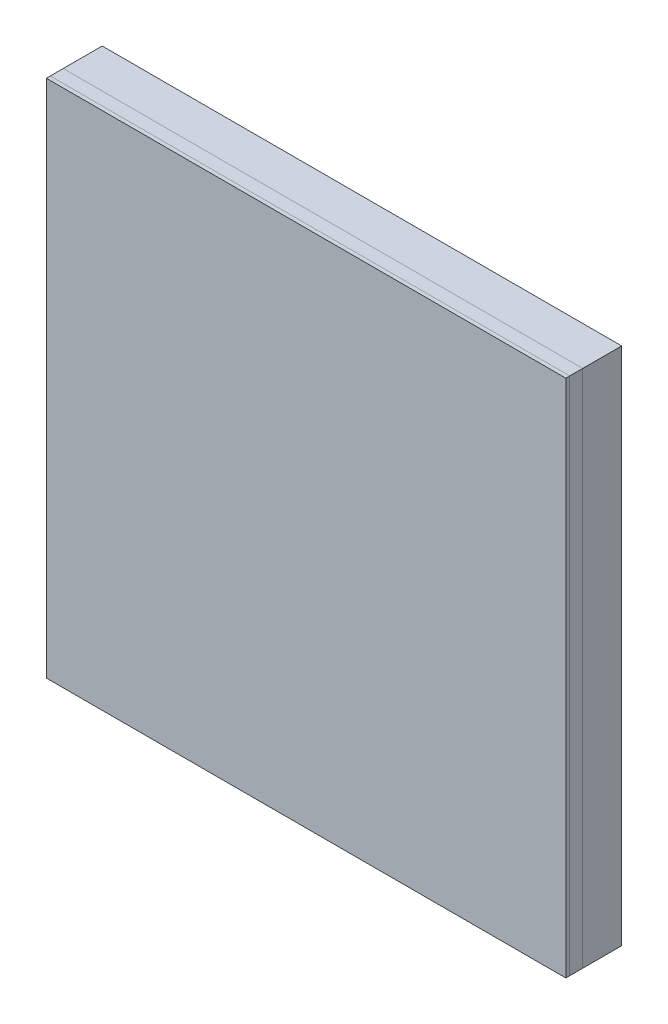
from build123d import *

# Parameters (mm, degrees)
EXTRUDE_340_DEPTH    = 0.6
EXTRUDE_519_DEPTH    = 0.065
EXTRUDE_519_2_DEPTH  = 0.065
SKETCH_2_W           = 7.8
SKETCH_2_H           = 0.65
EXTRUDE_519_3_DEPTH  = 0.065
EXTRUDE_START        = 0.6
EXTRUDE_2457_DEPTH   = 0.065
EXTRUDE_2457_2_DEPTH = 0.065
EXTRUDE_2457_3_DEPTH = 0.065
EXTRUDE_2457_4_DEPTH = 0.065
EXTRUDE_2457_5_DEPTH = 0.065
SKETCH_7_W           = 8
SKETCH_7_H           = 8
SKETCH_7_W_2         = 7.8
SKETCH_7_H_2         = 1.6503
SKETCH_7_H_3         = 1.334138265
SKETCH_7_H_4         = 1.2918
SKETCH_7_H_5         = 1.3338
EXTRUDE_2963_DEPTH   = 0.065
EXTRUDE_START_2      = 0.665
SKETCH_9_W           = 1.397
SKETCH_9_H           = 1.397
EXTRUDE_55E_DEPTH    = 0.135
EXTRUDE_55E_2_DEPTH  = 0.135
EXTRUDE_55E_3_DEPTH  = 0.135
EXTRUDE_55E_4_DEPTH  = 0.135
EXTRUDE_55E_5_DEPTH  = 0.135
EXTRUDE_55E_6_DEPTH  = 0.135
EXTRUDE_55E_7_DEPTH  = 0.135
EXTRUDE_55E_8_DEPTH  = 0.135
EXTRUDE_55E_9_DEPTH  = 0.135
EXTRUDE_55E_10_DEPTH = 0.135
EXTRUDE_55E_11_DEPTH = 0.135
EXTRUDE_55E_12_DEPTH = 0.135
EXTRUDE_55E_13_DEPTH = 0.135
EXTRUDE_55E_14_DEPTH = 0.135
EXTRUDE_55E_15_DEPTH = 0.135
EXTRUDE_55E_16_DEPTH = 0.135
SKETCH_10_W          = 1.397
SKETCH_10_H          = 1.397
EXTRUDE_4746_DEPTH   = 0.135
SKETCH_11_W          = 8
SKETCH_11_H          = 8
SKETCH_11_W_2        = 5.7448
SKETCH_11_H_2        = 5.7404
EXTRUDE_4922_DEPTH   = 0.135
CUT_EXTRUDE_35_DEPTH = 0.065
EXTRUDE_START_3      = 0.8
SKETCH_13_W          = 8
SKETCH_13_H          = 8
EXTRUDE_5314_DEPTH   = 0.06


with BuildPart() as part:
    # 草图1 → Extrude 340 (new body)
    with BuildSketch(Plane.XY):
        Polygon((0, 4), (-4, 4), (-4, -4), (4, -4), (4, 4), align=None)
    extrude(amount=EXTRUDE_340_DEPTH)


with BuildPart() as body_2:
    # 草图2 → Extrude 519 (new body)
    with BuildSketch(Plane.XY):
        Polygon((-3.6, 3.9), (-3.9, 3.6), (-3.9, 3.25), (3.9, 3.25), (3.9, 3.9), align=None)
    extrude(amount=-EXTRUDE_519_DEPTH)


with BuildPart() as body_3:
    # 草图2 → Extrude 519 2 (new body)
    with BuildSketch(Plane.XY):
        Polygon((-3.9, 0), (-3.9, 2.65), (3.9, 2.65), (3.9, -2.65), (-3.9, -2.65), align=None)
    extrude(amount=-EXTRUDE_519_2_DEPTH)

    # 草图12 → 背部35字符 (cut)
    with BuildSketch(Plane.XY):
        with BuildLine():
            add(Edge.make_bspline(
                [(0.175442408, 0.041162604), (0.171519721, 0.041314338), (0.163870978, 0.041610199), (0.152851761, 0.04431659), (0.142631687, 0.048502824), (0.134982054, 0.053530061), (0.129445763, 0.058209417), (0.125936778, 0.062275379), (0.122837738, 0.066580708), (0.120304091, 0.071296199), (0.118471723, 0.076449226), (0.117024538, 0.08190166), (0.116278483, 0.087757088), (0.116139105, 0.09175984), (0.116067408, 0.093818854)],
                knots=[0, 0, 0, 0, 1.580986218, 3.082722545, 4.552742743, 6.019301232, 6.756993619, 7.471942512, 8.18068244, 8.895476766, 9.623823266, 10.383578618, 11.168513387, 12, 12, 12, 12], degree=3))
            add(Edge.make_bspline(
                [(0.116067408, 0.093818854), (0.116216914, 0.096964342), (0.116510452, 0.103140136), (0.119311098, 0.11199984), (0.123801138, 0.120122187), (0.12986891, 0.127444304), (0.137465711, 0.133612633), (0.146519866, 0.138020548), (0.156769848, 0.140746835), (0.164018269, 0.141020399), (0.167786158, 0.141162604)],
                knots=[0, 0, 0, 0, 0.960649765, 1.886122081, 2.813754997, 3.787513425, 4.779794203, 5.785182105, 6.848688776, 8, 8, 8, 8], degree=3))
            add(Edge.make_bspline(
                [(0.167786158, 0.141162604), (0.170341454, 0.141136567), (0.175259806, 0.141086452), (0.182258513, 0.140184808), (0.188583301, 0.138912046), (0.194190908, 0.137024249), (0.199133873, 0.13464672), (0.203575189, 0.131977206), (0.207489402, 0.128964963), (0.212051434, 0.124230599), (0.21706547, 0.1169789), (0.222391493, 0.107126895), (0.227316857, 0.096614902), (0.230526301, 0.08957654), (0.232083033, 0.086162604)],
                knots=[0, 0, 0, 0, 0.998645702, 1.922161417, 2.755195104, 3.518563503, 4.229288931, 4.896574638, 5.542450423, 6.154682312, 7.460691044, 8.974324908, 10.532405416, 12, 12, 12, 12], degree=3))
            add(Edge.make_bspline(
                [(0.232083033, 0.086162604), (0.232579617, 0.085465166), (0.23362308, 0.083999651), (0.235768743, 0.082119364), (0.238513363, 0.080584415), (0.242836689, 0.078679435), (0.249221545, 0.077096017), (0.254572865, 0.076894106), (0.257395533, 0.076787604)],
                knots=[0, 0, 0, 0, 0.54905304, 1.153716077, 1.813972996, 2.563462152, 4.187324171, 6, 6, 6, 6], degree=3))
            add(Edge.make_bspline(
                [(0.257395533, 0.076787604), (0.259124248, 0.076903832), (0.262566898, 0.077135293), (0.267635215, 0.078686649), (0.272424407, 0.081338685), (0.276918918, 0.084875147), (0.280769959, 0.089324551), (0.28363611, 0.094554456), (0.285318935, 0.100514555), (0.285502977, 0.104693268), (0.285598658, 0.106865729)],
                knots=[0, 0, 0, 0, 0.905896502, 1.80404795, 2.750673374, 3.761079348, 4.787037981, 5.813178183, 6.863098672, 8, 8, 8, 8], degree=3))
            add(Edge.make_bspline(
                [(0.285598658, 0.106865729), (0.285484253, 0.109088145), (0.285250103, 0.113636727), (0.283565755, 0.120510428), (0.280993727, 0.127543367), (0.277334675, 0.134674754), (0.272750767, 0.141853475), (0.267090701, 0.14884406), (0.260542768, 0.155700128), (0.253056823, 0.162337487), (0.244558003, 0.168575648), (0.235069367, 0.174216688), (0.224606223, 0.17911399), (0.213284835, 0.18340974), (0.201102075, 0.186953824), (0.188126213, 0.189398034), (0.174463713, 0.190928665), (0.165134118, 0.191083462), (0.160364283, 0.191162604)],
                knots=[0, 0, 0, 0, 0.645752242, 1.321650284, 2.047444329, 2.819472764, 3.646981051, 4.519638315, 5.430040696, 6.400871145, 7.424586575, 8.490656944, 9.604921842, 10.779107617, 12.008414223, 13.288415452, 14.613679428, 16, 16, 16, 16], degree=3))
            add(Edge.make_bspline(
                [(0.160364283, 0.191162604), (0.156193319, 0.191106412), (0.148037178, 0.190996531), (0.136135993, 0.189588744), (0.124811779, 0.1875282), (0.114102018, 0.184544376), (0.103998927, 0.1808129), (0.094586291, 0.176294341), (0.08591036, 0.17092543), (0.077998231, 0.164835265), (0.070756547, 0.158256345), (0.064559958, 0.150966474), (0.059177429, 0.143240107), (0.054908401, 0.134908195), (0.051544788, 0.126235265), (0.04910542, 0.11723163), (0.047559572, 0.107908859), (0.04739871, 0.10155928), (0.047317408, 0.098350104)],
                knots=[0, 0, 0, 0, 1.221252691, 2.388106792, 3.505842288, 4.5904907, 5.640567108, 6.657386871, 7.643992698, 8.623612569, 9.579201759, 10.504338888, 11.420625851, 12.331689223, 13.239841177, 14.141141726, 15.060504284, 16, 16, 16, 16], degree=3))
            add(Edge.make_bspline(
                [(0.047317408, 0.098350104), (0.047436658, 0.094198044), (0.047667086, 0.086174951), (0.049893137, 0.074612717), (0.05320455, 0.063881914), (0.058355652, 0.05410974), (0.064638747, 0.044890202), (0.07205683, 0.03588914), (0.080590582, 0.026921414), (0.086983874, 0.021320982), (0.090286158, 0.018428229)],
                knots=[0, 0, 0, 0, 1.057467846, 2.043362414, 2.992503693, 3.910137418, 4.847546316, 5.833798593, 6.881106603, 8, 8, 8, 8], degree=3))
            add(Edge.make_bspline(
                [(0.090286158, 0.018428229), (0.087052465, 0.016576363), (0.080733095, 0.012957398), (0.07192562, 0.006786304), (0.063898498, 0.000268343), (0.056660238, -0.006652686), (0.050179007, -0.013915609), (0.044675412, -0.021697518), (0.039814386, -0.02973678), (0.036031374, -0.038246473), (0.032930291, -0.047035927), (0.030740639, -0.05619598), (0.029491939, -0.06572998), (0.029293343, -0.072193176), (0.029192408, -0.075478021)],
                knots=[0, 0, 0, 0, 1.135957983, 2.219919329, 3.275490454, 4.286593445, 5.271307177, 6.238864924, 7.189587433, 8.13147822, 9.073369008, 10.028823401, 10.99817223, 12, 12, 12, 12], degree=3))
            add(Edge.make_bspline(
                [(0.029192408, -0.075478021), (0.02928114, -0.079444145), (0.02945779, -0.087339996), (0.031391939, -0.099047967), (0.034232931, -0.110611511), (0.03839069, -0.121880662), (0.043619343, -0.132739152), (0.049908103, -0.143084856), (0.057374991, -0.152771919), (0.065859247, -0.161854678), (0.075449872, -0.170022524), (0.085860287, -0.177479623), (0.097362485, -0.183726781), (0.109587446, -0.189256604), (0.122704556, -0.193565572), (0.1365605, -0.196544168), (0.151115738, -0.19850864), (0.161060795, -0.198726174), (0.166145533, -0.198837396)],
                knots=[0, 0, 0, 0, 0.9244463, 1.840408962, 2.761354961, 3.69929812, 4.636768923, 5.569324905, 6.518359109, 7.485424071, 8.463344184, 9.452821288, 10.467202204, 11.511560322, 12.579767899, 13.680916014, 14.81429176, 16, 16, 16, 16], degree=3))
            add(Edge.make_bspline(
                [(0.166145533, -0.198837396), (0.171283978, -0.198711061), (0.181345476, -0.198463687), (0.195994779, -0.196273543), (0.209890073, -0.192910839), (0.222791577, -0.187927233), (0.234761614, -0.18197973), (0.245691961, -0.175284513), (0.255557894, -0.167913773), (0.264232686, -0.159856025), (0.271764177, -0.15130259), (0.278425302, -0.142656368), (0.284147138, -0.133861244), (0.288636386, -0.12497985), (0.292235589, -0.116461164), (0.29481401, -0.108597917), (0.296534039, -0.101514244), (0.296802025, -0.097022309), (0.296926783, -0.094931146)],
                knots=[0, 0, 0, 0, 1.351773256, 2.646883745, 3.890430205, 5.107491429, 6.278512547, 7.404761987, 8.47682912, 9.514804149, 10.514971582, 11.473298805, 12.385970853, 13.271945138, 14.089230246, 14.817566368, 15.449533281, 16, 16, 16, 16], degree=3))
            add(Edge.make_bspline(
                [(0.296926783, -0.094931146), (0.2968177, -0.092521337), (0.296606558, -0.087856906), (0.294665592, -0.08126253), (0.29156662, -0.075376915), (0.287217276, -0.070398749), (0.28198391, -0.066283941), (0.275959138, -0.063440521), (0.269390756, -0.061488029), (0.264780444, -0.061337262), (0.262395533, -0.061259271)],
                knots=[0, 0, 0, 0, 1.06810488, 2.067426331, 3.024698845, 4.000723518, 4.981670045, 5.959338089, 6.944367374, 8, 8, 8, 8], degree=3))
            add(Edge.make_bspline(
                [(0.262395533, -0.061259271), (0.259945039, -0.061438344), (0.254985665, -0.061800756), (0.249232677, -0.064300257), (0.245081625, -0.066828599), (0.242497565, -0.069011166), (0.240446678, -0.071361175), (0.239599941, -0.073138312), (0.239192408, -0.073993646)],
                knots=[0, 0, 0, 0, 1.582584474, 3.202875989, 3.998968195, 4.729379107, 5.388451751, 6, 6, 6, 6], degree=3))
            add(Edge.make_bspline(
                [(0.239192408, -0.073993646), (0.236961501, -0.079553065), (0.232738845, -0.090075918), (0.225439686, -0.104386754), (0.218086107, -0.116566473), (0.21144321, -0.125123878), (0.205798189, -0.130794629), (0.20117743, -0.13423482), (0.196253038, -0.137237469), (0.190898034, -0.139659194), (0.185161263, -0.141545528), (0.179002239, -0.142836536), (0.172474942, -0.143752083), (0.167971802, -0.143808595), (0.165676783, -0.143837396)],
                knots=[0, 0, 0, 0, 1.970214234, 3.729216073, 5.279728687, 6.646098805, 7.282342263, 7.906173718, 8.536620377, 9.177005041, 9.835480032, 10.519551211, 11.245491345, 12, 12, 12, 12], degree=3))
            add(Edge.make_bspline(
                [(0.165676783, -0.143837396), (0.162961323, -0.14375482), (0.15754131, -0.143589999), (0.149520299, -0.142018285), (0.141662122, -0.139584748), (0.13399682, -0.136246371), (0.126741681, -0.131901683), (0.120120274, -0.12650765), (0.114137403, -0.120221849), (0.108938292, -0.113015012), (0.104498899, -0.105134228), (0.101482146, -0.096453791), (0.099520016, -0.087232769), (0.099303328, -0.080853097), (0.099192408, -0.077587396)],
                knots=[0, 0, 0, 0, 0.934810175, 1.865865643, 2.805358813, 3.765705778, 4.739872594, 5.709689967, 6.69988526, 7.721186175, 8.765372185, 9.804223383, 10.876000366, 12, 12, 12, 12], degree=3))
            add(Edge.make_bspline(
                [(0.099192408, -0.077587396), (0.099229768, -0.075163404), (0.099302687, -0.070432182), (0.100089968, -0.063554709), (0.101422049, -0.057068856), (0.103289168, -0.0510032), (0.10563468, -0.045306873), (0.108543788, -0.040039056), (0.112002241, -0.035163888), (0.115989951, -0.030712728), (0.120441472, -0.026727391), (0.125312834, -0.023259118), (0.130604628, -0.020382499), (0.136245625, -0.017892608), (0.142387017, -0.01615919), (0.148888662, -0.014838536), (0.155807172, -0.013917559), (0.16056949, -0.013864635), (0.163020533, -0.013837396)],
                knots=[0, 0, 0, 0, 1.136267686, 2.217802884, 3.240445259, 4.237017945, 5.189521199, 6.124165902, 7.052567298, 7.986573582, 8.920579866, 9.848981262, 10.783625965, 11.74089235, 12.733942375, 13.768545039, 14.851527015, 16, 16, 16, 16], degree=3))
            add(Edge.make_bspline(
                [(0.163020533, -0.013837396), (0.164010071, -0.013862438), (0.166250205, -0.013919128), (0.169980981, -0.014039105), (0.174426273, -0.014498416), (0.17932356, -0.014920018), (0.184059535, -0.015376807), (0.188121117, -0.015715819), (0.191170967, -0.015857493), (0.192890303, -0.015921546), (0.193567408, -0.015946771)],
                knots=[0, 0, 0, 0, 0.775683707, 1.756005479, 2.923594717, 4.275922316, 5.607929333, 6.651814213, 7.469060447, 8, 8, 8, 8], degree=3))
            add(Edge.make_bspline(
                [(0.193567408, -0.015946771), (0.195868614, -0.01587148), (0.200232871, -0.01572869), (0.206353983, -0.01426876), (0.21173829, -0.012054591), (0.216200204, -0.008700022), (0.21965488, -0.004483474), (0.222247802, 0.000412579), (0.223735742, 0.006077184), (0.223881806, 0.010086075), (0.223958033, 0.012178229)],
                knots=[0, 0, 0, 0, 1.17258274, 2.223813143, 3.194361778, 4.124937544, 5.040676748, 5.956415951, 6.933497897, 8, 8, 8, 8], degree=3))
            add(Edge.make_bspline(
                [(0.223958033, 0.012178229), (0.223829951, 0.014246226), (0.22358043, 0.018274974), (0.221863929, 0.024039995), (0.218769587, 0.029088863), (0.214546406, 0.033450977), (0.209115653, 0.037048063), (0.202452741, 0.039456145), (0.194703041, 0.040969146), (0.189174559, 0.041095279), (0.186223658, 0.041162604)],
                knots=[0, 0, 0, 0, 0.923199915, 1.798522494, 2.65392836, 3.541976324, 4.490026617, 5.535129127, 6.684342027, 8, 8, 8, 8], degree=3))
            Line((0.186223658, 0.041162604), (0.175442408, 0.041162604))
        make_face()
        with BuildLine():
            Line((-0.247213842, 0.131162604), (-0.121901342, 0.131162604))
            Line((-0.121901342, 0.131162604), (-0.106901342, 0.044912604))
            add(Edge.make_bspline(
                [(-0.106901342, 0.044912604), (-0.109982362, 0.046614048), (-0.115990712, 0.049932064), (-0.125111212, 0.054220359), (-0.134003752, 0.057942855), (-0.14276528, 0.060879021), (-0.151302523, 0.063291132), (-0.159694765, 0.06489861), (-0.167887936, 0.065994093), (-0.17330421, 0.066107109), (-0.175963842, 0.066162604)],
                knots=[0, 0, 0, 0, 1.156031135, 2.254395925, 3.309385178, 4.321273619, 5.288520282, 6.221443175, 7.12664928, 8, 8, 8, 8], degree=3))
            add(Edge.make_bspline(
                [(-0.175963842, 0.066162604), (-0.180110906, 0.066038176), (-0.188339808, 0.065791276), (-0.200436194, 0.063954476), (-0.212149651, 0.060979839), (-0.223331373, 0.056748916), (-0.233981353, 0.051516745), (-0.243918819, 0.045330059), (-0.253165501, 0.038250075), (-0.261569029, 0.030207336), (-0.269174167, 0.021312108), (-0.276018849, 0.011702307), (-0.281870908, 0.001226449), (-0.286880304, -0.009922825), (-0.29084049, -0.021700454), (-0.29375498, -0.033956804), (-0.295520311, -0.046676274), (-0.295710939, -0.055316148), (-0.295807592, -0.059696771)],
                knots=[0, 0, 0, 0, 1.026774098, 2.037398737, 3.022891862, 4.014779989, 4.992582191, 5.957214377, 6.909237301, 7.871775813, 8.832259396, 9.803937804, 10.788713117, 11.799152522, 12.827080561, 13.861121089, 14.91553709, 16, 16, 16, 16], degree=3))
            add(Edge.make_bspline(
                [(-0.295807592, -0.059696771), (-0.295625908, -0.065986598), (-0.295267745, -0.078386098), (-0.29202947, -0.096508525), (-0.286895116, -0.11379673), (-0.280777068, -0.127379796), (-0.274995093, -0.137681454), (-0.270114291, -0.144976743), (-0.264794226, -0.151872525), (-0.258993083, -0.15836695), (-0.252727794, -0.16450647), (-0.245915965, -0.170160838), (-0.238733766, -0.175523547), (-0.231057771, -0.18033601), (-0.223051413, -0.184734014), (-0.214624937, -0.18847968), (-0.205892618, -0.191708689), (-0.196778458, -0.194225482), (-0.187417331, -0.196419834), (-0.177660928, -0.197756242), (-0.167595184, -0.198650102), (-0.160757558, -0.198774398), (-0.157291967, -0.198837396)],
                knots=[0, 0, 0, 0, 1.710997997, 3.372989692, 4.994512092, 6.609761535, 7.41610176, 8.208484316, 8.996892774, 9.785205607, 10.577302694, 11.382426601, 12.193458955, 13.015569817, 13.84670929, 14.678090601, 15.523617978, 16.378602788, 17.250583037, 18.138866061, 19.056700722, 20, 20, 20, 20], degree=3))
            add(Edge.make_bspline(
                [(-0.157291967, -0.198837396), (-0.153435486, -0.198811565), (-0.145920491, -0.198761229), (-0.134925263, -0.197812641), (-0.124470843, -0.196586242), (-0.114600263, -0.194571943), (-0.105267375, -0.192189142), (-0.096508296, -0.189234632), (-0.088310955, -0.185690826), (-0.078357156, -0.180380618), (-0.067252178, -0.172984792), (-0.055600209, -0.163383004), (-0.046091391, -0.153055494), (-0.038933247, -0.14211243), (-0.033632066, -0.131323999), (-0.02970268, -0.121119173), (-0.027288168, -0.111553128), (-0.026919423, -0.105359362), (-0.026745092, -0.102431146)],
                knots=[0, 0, 0, 0, 1.032122537, 2.011262572, 2.953048671, 3.848692781, 4.706095702, 5.530723847, 6.320819668, 7.09434419, 8.548563684, 9.884968699, 11.12878924, 12.291001741, 13.373000139, 14.341657643, 15.215988225, 16, 16, 16, 16], degree=3))
            add(Edge.make_bspline(
                [(-0.026745092, -0.102431146), (-0.026856929, -0.10072688), (-0.027081841, -0.097299512), (-0.028735095, -0.09226633), (-0.03146587, -0.087436848), (-0.035198005, -0.082905187), (-0.039661176, -0.078879694), (-0.044891498, -0.075885229), (-0.050695061, -0.074119033), (-0.054753827, -0.073932501), (-0.056823217, -0.073837396)],
                knots=[0, 0, 0, 0, 0.891955951, 1.793770362, 2.746572068, 3.784286437, 4.857277243, 5.877717021, 6.91793968, 8, 8, 8, 8], degree=3))
            add(Edge.make_bspline(
                [(-0.056823217, -0.073837396), (-0.058626137, -0.073909707), (-0.062142154, -0.074050726), (-0.067236519, -0.075235411), (-0.071918914, -0.077326641), (-0.076263042, -0.080184099), (-0.080275964, -0.08381206), (-0.083879305, -0.088251016), (-0.087118322, -0.093483765), (-0.088873035, -0.097356266), (-0.089791967, -0.099384271)],
                knots=[0, 0, 0, 0, 0.971980174, 1.895536086, 2.801396063, 3.724951974, 4.689900168, 5.708100931, 6.799746478, 8, 8, 8, 8], degree=3))
            add(Edge.make_bspline(
                [(-0.089791967, -0.099384271), (-0.091591502, -0.103139762), (-0.0951011, -0.110464022), (-0.101935053, -0.120225218), (-0.109476254, -0.12885196), (-0.117998525, -0.136008808), (-0.127213587, -0.141823306), (-0.137160825, -0.145772685), (-0.147541913, -0.148449707), (-0.154696952, -0.148707371), (-0.158307592, -0.148837396)],
                knots=[0, 0, 0, 0, 1.114133718, 2.172872781, 3.181178178, 4.176482046, 5.144706507, 6.086753413, 7.034520209, 8, 8, 8, 8], degree=3))
            add(Edge.make_bspline(
                [(-0.158307592, -0.148837396), (-0.161601544, -0.148739984), (-0.168047954, -0.148549343), (-0.177317967, -0.146393667), (-0.186030345, -0.143211037), (-0.194000453, -0.138559549), (-0.201176166, -0.132707675), (-0.207687236, -0.126001932), (-0.213077958, -0.118093806), (-0.217668539, -0.109367716), (-0.221354352, -0.09983295), (-0.223893116, -0.089594674), (-0.225497889, -0.078757711), (-0.22570275, -0.071317158), (-0.225807592, -0.067509271)],
                knots=[0, 0, 0, 0, 0.999365855, 1.955803753, 2.877615458, 3.810339756, 4.744909539, 5.685493777, 6.640686185, 7.642713055, 8.677591865, 9.739247965, 10.843004161, 12, 12, 12, 12], degree=3))
            add(Edge.make_bspline(
                [(-0.225807592, -0.067509271), (-0.225718314, -0.063439813), (-0.225545753, -0.055574167), (-0.223779936, -0.044256285), (-0.221008284, -0.033853961), (-0.217087775, -0.024436957), (-0.212240238, -0.016040955), (-0.20660744, -0.008715869), (-0.200187683, -0.002486302), (-0.192984722, 0.002506084), (-0.185177483, 0.006310272), (-0.176991048, 0.009198091), (-0.16832196, 0.010852262), (-0.162402898, 0.011058182), (-0.159401342, 0.011162604)],
                knots=[0, 0, 0, 0, 1.264287676, 2.443677061, 3.551416063, 4.603930053, 5.605153171, 6.557385042, 7.467809554, 8.375168957, 9.269503561, 10.160533826, 11.067206671, 12, 12, 12, 12], degree=3))
            add(Edge.make_bspline(
                [(-0.159401342, 0.011162604), (-0.155880976, 0.011132295), (-0.149366838, 0.011076209), (-0.140403856, 0.009946723), (-0.132967988, 0.008390334), (-0.126777692, 0.005755143), (-0.121097472, 0.002067915), (-0.114583786, -0.002174271), (-0.107099653, -0.007645251), (-0.098927436, -0.013760732), (-0.090628723, -0.019656161), (-0.082689063, -0.024087101), (-0.075478289, -0.026969102), (-0.070827518, -0.027393219), (-0.068698217, -0.027587396)],
                knots=[0, 0, 0, 0, 1.253295908, 2.319117763, 3.214971802, 3.9509325, 4.700515206, 5.624476455, 6.721551364, 8.002169915, 9.263410726, 10.343199062, 11.241452929, 12, 12, 12, 12], degree=3))
            add(Edge.make_bspline(
                [(-0.068698217, -0.027587396), (-0.066576424, -0.02746212), (-0.062417141, -0.027216545), (-0.056351791, -0.025399635), (-0.050696158, -0.022406674), (-0.045617791, -0.018263447), (-0.041315229, -0.013474862), (-0.038061425, -0.00820874), (-0.036084515, -0.002541757), (-0.035848067, 0.001381986), (-0.035729467, 0.003350104)],
                knots=[0, 0, 0, 0, 1.021493999, 2.002401241, 3.024126496, 4.086435777, 5.144287797, 6.112833732, 7.053412325, 8, 8, 8, 8], degree=3))
            add(Edge.make_bspline(
                [(-0.035729467, 0.003350104), (-0.035776783, 0.003897554), (-0.035928466, 0.005652521), (-0.036540757, 0.009214265), (-0.03748528, 0.014701892), (-0.038205505, 0.019000607), (-0.038620092, 0.021475104)],
                knots=[0, 0, 0, 0, 0.3590892, 1.151136812, 2.360091093, 4, 4, 4, 4], degree=3))
            Line((-0.038620092, 0.021475104), (-0.060729467, 0.149287604))
            add(Edge.make_bspline(
                [(-0.060729467, 0.149287604), (-0.06140305, 0.152718945), (-0.062672021, 0.159183293), (-0.065691781, 0.168014386), (-0.069518115, 0.175358432), (-0.074234845, 0.18136432), (-0.080328928, 0.185973554), (-0.08795025, 0.18900705), (-0.097045346, 0.190882647), (-0.103609395, 0.191064766), (-0.107135717, 0.191162604)],
                knots=[0, 0, 0, 0, 1.194655266, 2.250626509, 3.178731457, 4.014469511, 4.840762815, 5.758559939, 6.795859391, 8, 8, 8, 8], degree=3))
            Line((-0.107135717, 0.191162604), (-0.245651342, 0.191162604))
            add(Edge.make_bspline(
                [(-0.245651342, 0.191162604), (-0.248755768, 0.191083587), (-0.254584479, 0.19093523), (-0.262762156, 0.189567564), (-0.269702248, 0.187184088), (-0.275484986, 0.183859276), (-0.280011859, 0.179485369), (-0.283100618, 0.174022537), (-0.285039668, 0.167697771), (-0.285235814, 0.163157039), (-0.285338842, 0.160771979)],
                knots=[0, 0, 0, 0, 1.306773136, 2.453530613, 3.476791313, 4.381515022, 5.242365076, 6.092600397, 6.998121453, 8, 8, 8, 8], degree=3))
            add(Edge.make_bspline(
                [(-0.285338842, 0.160771979), (-0.285219504, 0.158650448), (-0.28498795, 0.154533972), (-0.283164323, 0.148666464), (-0.279966119, 0.143551548), (-0.275748019, 0.139014073), (-0.270190756, 0.135501345), (-0.263557693, 0.132869667), (-0.255733274, 0.131481767), (-0.250161346, 0.131273026), (-0.247213842, 0.131162604)],
                knots=[0, 0, 0, 0, 0.934066646, 1.812400468, 2.672477074, 3.573532411, 4.518880718, 5.543899773, 6.700743026, 8, 8, 8, 8], degree=3))
        make_face()
    extrude(amount=-CUT_EXTRUDE_35_DEPTH, mode=Mode.SUBTRACT)


with BuildPart() as body_4:
    # 草图2 → Extrude 519 3 (new body)
    with BuildSketch(Plane.XY):
        with Locations((0, -3.575)):
            Rectangle(SKETCH_2_W, SKETCH_2_H)
    extrude(amount=-EXTRUDE_519_3_DEPTH)


with BuildPart() as body_5:
    # 草图4 → Extrude 2457 (new body)
    with BuildSketch(Plane.XY.offset(EXTRUDE_START)):
        Polygon((-3.9, 3.9), (3.9, 3.9), (3.9, 2.2497), (2.7919, 2.2497), (-3.9, 2.2497), align=None)
        Polygon((2.7919, 2.7807), (2.6419, 2.7807), (2.6419, 2.8807), (2.8919, 2.8807), (2.8919, 2.6307), (2.7919, 2.6307), align=None, mode=Mode.SUBTRACT)
        Polygon((-2.8919, 2.8807), (-2.6419, 2.8807), (-2.6419, 2.7807), (-2.7919, 2.7807), (-2.7919, 2.6307), (-2.8919, 2.6307), align=None, mode=Mode.SUBTRACT)
    extrude(amount=EXTRUDE_2457_DEPTH)


with BuildPart() as body_6:
    # 草图4 → Extrude 2457 2 (new body)
    with BuildSketch(Plane.XY.offset(EXTRUDE_START)):
        Polygon((-3.9, -3.549081497), (-3.55, -3.899081497), (3.55, -3.899081497), (3.9, -3.549081497), (3.9, -2.248781497), (2.7919, -2.248781497), (-3.9, -2.248781497), align=None)
        Polygon((-2.7919, -2.779781497), (-2.6419, -2.779781497), (-2.6419, -2.879781497), (-2.8919, -2.879781497), (-2.8919, -2.629781497), (-2.7919, -2.629781497), align=None, mode=Mode.SUBTRACT)
        Polygon((2.8919, -2.879781497), (2.6419, -2.879781497), (2.6419, -2.779781497), (2.7919, -2.779781497), (2.7919, -2.629781497), (2.8919, -2.629781497), align=None, mode=Mode.SUBTRACT)
    extrude(amount=EXTRUDE_2457_2_DEPTH)


with BuildPart() as body_7:
    # 草图4 → Extrude 2457 3 (new body)
    with BuildSketch(Plane.XY.offset(EXTRUDE_START)):
        Polygon((-2.7919, -2.1147), (-3.9, -2.1147), (-3.9, -0.7809), (2.7919, -0.7809), (3.9, -0.7809), (3.9, -2.1147), align=None)
    extrude(amount=EXTRUDE_2457_3_DEPTH)


with BuildPart() as body_8:
    # 草图4 → Extrude 2457 4 (new body)
    with BuildSketch(Plane.XY.offset(EXTRUDE_START)):
        Polygon((-2.7919, -0.6459), (-3.9, -0.6459), (-3.9, 0.6459), (2.7919, 0.6459), (3.9, 0.6459), (3.9, -0.6459), align=None)
    extrude(amount=EXTRUDE_2457_4_DEPTH)


with BuildPart() as body_9:
    # 草图4 → Extrude 2457 5 (new body)
    with BuildSketch(Plane.XY.offset(EXTRUDE_START)):
        Polygon((-2.7919, 0.7809), (-3.9, 0.7809), (-3.9, 2.1147), (-2.7919, 2.1147), (3.9, 2.1147), (3.9, 0.7809), align=None)
    extrude(amount=EXTRUDE_2457_5_DEPTH)


with BuildPart() as body_10:
    # 草图7 → Extrude 2963 (new body)
    with BuildSketch(Plane.XY.offset(EXTRUDE_START)):
        Rectangle(SKETCH_7_W, SKETCH_7_H)
        with Locations((0, 3.07485)):
            Rectangle(SKETCH_7_W_2, SKETCH_7_H_2, mode=Mode.SUBTRACT)
        with Locations((0, 1.447630868)):
            Rectangle(SKETCH_7_W_2, SKETCH_7_H_3, mode=Mode.SUBTRACT)
        Rectangle(SKETCH_7_W_2, SKETCH_7_H_4, mode=Mode.SUBTRACT)
        with Locations((0, -1.4478)):
            Rectangle(SKETCH_7_W_2, SKETCH_7_H_5, mode=Mode.SUBTRACT)
        Polygon((-3.9, -3.549081497), (-3.9, -2.248781497), (3.9, -2.248781497), (3.9, -3.549081497), (3.55, -3.899081497), (-3.55, -3.899081497), align=None, mode=Mode.SUBTRACT)
    extrude(amount=EXTRUDE_2963_DEPTH)


with BuildPart() as body_11:
    # 草图9 → 三安55e核心 (new body)
    with BuildSketch(Plane.XY.offset(EXTRUDE_START_2)):
        with Locations((-2.1739, 2.1717)):
            Rectangle(SKETCH_9_W, SKETCH_9_H)
    extrude(amount=EXTRUDE_55E_DEPTH)


with BuildPart() as body_12:
    # 草图9 → Extrude 55e 2 (new body)
    with BuildSketch(Plane.XY.offset(EXTRUDE_START_2)):
        with Locations((-0.7239, 2.1717)):
            Rectangle(SKETCH_9_W, SKETCH_9_H)
    extrude(amount=EXTRUDE_55E_2_DEPTH)


with BuildPart() as body_13:
    # 草图9 → Extrude 55e 3 (new body)
    with BuildSketch(Plane.XY.offset(EXTRUDE_START_2)):
        with Locations((0.7239, 2.1717)):
            Rectangle(SKETCH_9_W, SKETCH_9_H)
    extrude(amount=EXTRUDE_55E_3_DEPTH)


with BuildPart() as body_14:
    # 草图9 → Extrude 55e 4 (new body)
    with BuildSketch(Plane.XY.offset(EXTRUDE_START_2)):
        with Locations((2.1739, 2.1717)):
            Rectangle(SKETCH_9_W, SKETCH_9_H)
    extrude(amount=EXTRUDE_55E_4_DEPTH)


with BuildPart() as body_15:
    # 草图9 → Extrude 55e 5 (new body)
    with BuildSketch(Plane.XY.offset(EXTRUDE_START_2)):
        with Locations((2.1739, 0.7239)):
            Rectangle(SKETCH_9_W, SKETCH_9_H)
    extrude(amount=EXTRUDE_55E_5_DEPTH)


with BuildPart() as body_16:
    # 草图9 → Extrude 55e 6 (new body)
    with BuildSketch(Plane.XY.offset(EXTRUDE_START_2)):
        with Locations((2.1739, -0.7239)):
            Rectangle(SKETCH_9_W, SKETCH_9_H)
    extrude(amount=EXTRUDE_55E_6_DEPTH)


with BuildPart() as body_17:
    # 草图9 → Extrude 55e 7 (new body)
    with BuildSketch(Plane.XY.offset(EXTRUDE_START_2)):
        with Locations((2.1739, -2.1717)):
            Rectangle(SKETCH_9_W, SKETCH_9_H)
    extrude(amount=EXTRUDE_55E_7_DEPTH)


with BuildPart() as body_18:
    # 草图9 → Extrude 55e 8 (new body)
    with BuildSketch(Plane.XY.offset(EXTRUDE_START_2)):
        with Locations((0.7239, -2.1717)):
            Rectangle(SKETCH_9_W, SKETCH_9_H)
    extrude(amount=EXTRUDE_55E_8_DEPTH)


with BuildPart() as body_19:
    # 草图9 → Extrude 55e 9 (new body)
    with BuildSketch(Plane.XY.offset(EXTRUDE_START_2)):
        with Locations((0.7239, -0.7239)):
            Rectangle(SKETCH_9_W, SKETCH_9_H)
    extrude(amount=EXTRUDE_55E_9_DEPTH)


with BuildPart() as body_20:
    # 草图9 → Extrude 55e 10 (new body)
    with BuildSketch(Plane.XY.offset(EXTRUDE_START_2)):
        with Locations((0.7239, 0.7239)):
            Rectangle(SKETCH_9_W, SKETCH_9_H)
    extrude(amount=EXTRUDE_55E_10_DEPTH)


with BuildPart() as body_21:
    # 草图9 → Extrude 55e 11 (new body)
    with BuildSketch(Plane.XY.offset(EXTRUDE_START_2)):
        with Locations((-0.7239, 0.7239)):
            Rectangle(SKETCH_9_W, SKETCH_9_H)
    extrude(amount=EXTRUDE_55E_11_DEPTH)


with BuildPart() as body_22:
    # 草图9 → Extrude 55e 12 (new body)
    with BuildSketch(Plane.XY.offset(EXTRUDE_START_2)):
        with Locations((-0.7239, -0.7239)):
            Rectangle(SKETCH_9_W, SKETCH_9_H)
    extrude(amount=EXTRUDE_55E_12_DEPTH)


with BuildPart() as body_23:
    # 草图9 → Extrude 55e 13 (new body)
    with BuildSketch(Plane.XY.offset(EXTRUDE_START_2)):
        with Locations((-0.7239, -2.1717)):
            Rectangle(SKETCH_9_W, SKETCH_9_H)
    extrude(amount=EXTRUDE_55E_13_DEPTH)


with BuildPart() as body_24:
    # 草图9 → Extrude 55e 14 (new body)
    with BuildSketch(Plane.XY.offset(EXTRUDE_START_2)):
        with Locations((-2.1739, -2.1717)):
            Rectangle(SKETCH_9_W, SKETCH_9_H)
    extrude(amount=EXTRUDE_55E_14_DEPTH)


with BuildPart() as body_25:
    # 草图9 → Extrude 55e 15 (new body)
    with BuildSketch(Plane.XY.offset(EXTRUDE_START_2)):
        with Locations((-2.1739, -0.7239)):
            Rectangle(SKETCH_9_W, SKETCH_9_H)
    extrude(amount=EXTRUDE_55E_15_DEPTH)


with BuildPart() as body_26:
    # 草图9 → Extrude 55e 16 (new body)
    with BuildSketch(Plane.XY.offset(EXTRUDE_START_2)):
        with Locations((-2.1739, 0.7239)):
            Rectangle(SKETCH_9_W, SKETCH_9_H)
    extrude(amount=EXTRUDE_55E_16_DEPTH)


with BuildPart() as body_27:
    # 草图10 → Extrude 4746 (new body)
    with BuildSketch(Plane.XY.offset(EXTRUDE_START_2)):
        Polygon((-1.4754, 2.8702), (-1.4224, 2.8702), (-1.4224, 1.4732), (-0.0254, 1.4732), (-0.0254, 2.8702), (0.0254, 2.8702), (0.0254, 1.4732), (1.4224, 1.4732), (1.4224, 2.8702), (1.4754, 2.8702), (1.4754, 1.4732), (2.8724, 1.4732), (2.8724, 1.4224), (1.4754, 1.4224), (1.4754, 0.0254), (2.8724, 0.0254), (2.8724, -0.0254), (1.4754, -0.0254), (1.4754, -1.4224), (2.8724, -1.4224), (2.8724, -1.4732), (1.4754, -1.4732), (1.4754, -2.8702), (1.4224, -2.8702), (1.4224, -1.4732), (0.0254, -1.4732), (0.0254, -2.8702), (-0.0254, -2.8702), (-0.0254, -1.4732), (-1.4224, -1.4732), (-1.4224, -2.8702), (-1.4754, -2.8702), (-1.4754, -1.4732), (-2.8724, -1.4732), (-2.8724, -1.4224), (-1.4754, -1.4224), (-1.4754, -0.0254), (-2.8724, -0.0254), (-2.8724, 0.0254), (-1.4754, 0.0254), (-1.4754, 1.4224), (-2.8724, 1.4224), (-2.8724, 1.4732), (-1.4754, 1.4732), align=None)
        with Locations((-0.7239, 0.7239)):
            Rectangle(SKETCH_10_W, SKETCH_10_H, mode=Mode.SUBTRACT)
        with Locations((0.7239, 0.7239)):
            Rectangle(SKETCH_10_W, SKETCH_10_H, mode=Mode.SUBTRACT)
        with Locations((0.7239, -0.7239)):
            Rectangle(SKETCH_10_W, SKETCH_10_H, mode=Mode.SUBTRACT)
        with Locations((-0.7239, -0.7239)):
            Rectangle(SKETCH_10_W, SKETCH_10_H, mode=Mode.SUBTRACT)
    extrude(amount=EXTRUDE_4746_DEPTH)


    add(body_10.part)  # Extrude 4922 merges body 10
    # 草图11 → Extrude 4922 (add)
    with BuildSketch(Plane.XY.offset(EXTRUDE_START_2)):
        Rectangle(SKETCH_11_W, SKETCH_11_H)
        Rectangle(SKETCH_11_W_2, SKETCH_11_H_2, mode=Mode.SUBTRACT)
    extrude(amount=EXTRUDE_4922_DEPTH)


with BuildPart() as body_27_2:
    # 草图13 → Extrude 5314 (new body)
    with BuildSketch(Plane.XY.offset(EXTRUDE_START_3)):
        Rectangle(SKETCH_13_W, SKETCH_13_H)
    extrude(amount=EXTRUDE_5314_DEPTH)


solid = Compound([part.part, body_2.part, body_3.part, body_4.part, body_5.part, body_6.part, body_7.part, body_8.part, body_9.part, body_11.part, body_12.part, body_13.part, body_14.part, body_15.part, body_16.part, body_17.part, body_18.part, body_19.part, body_20.part, body_21.part, body_22.part, body_23.part, body_24.part, body_25.part, body_26.part, body_27.part, body_27_2.part])
